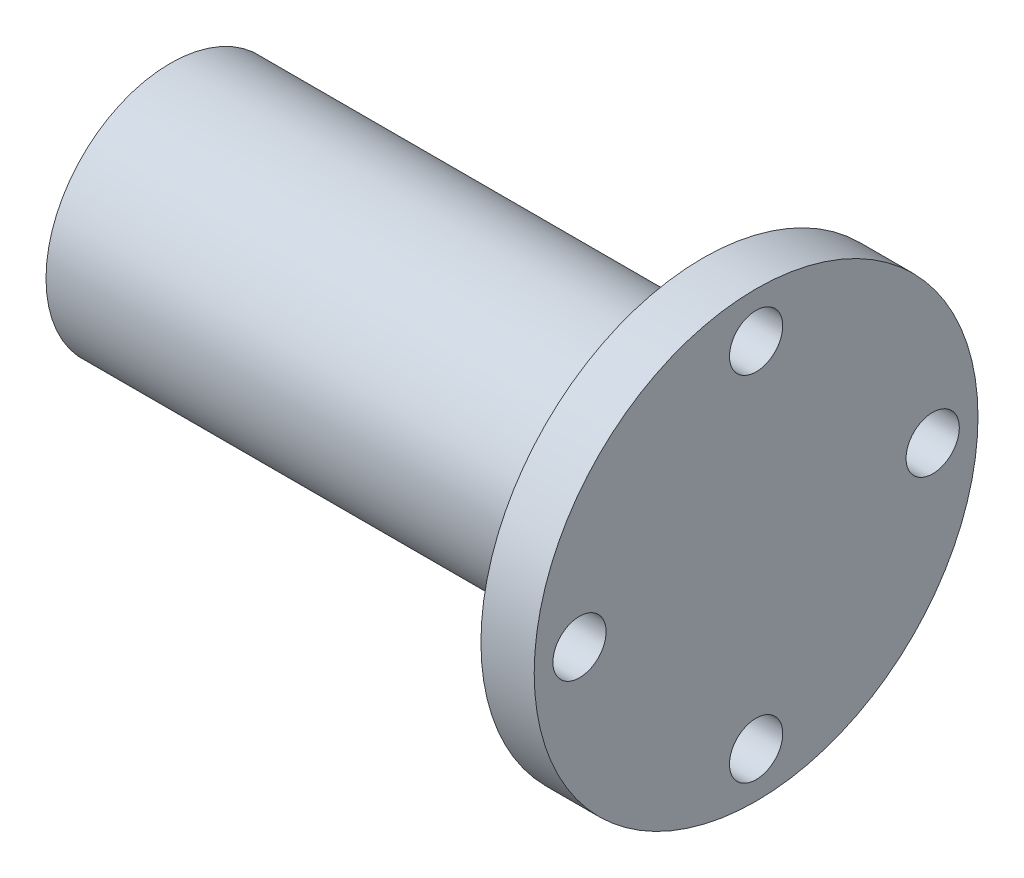
from build123d import *

# Parameters (mm, degrees)
SKETCH1_R           = 7
BOSS_EXTRUDE1_DEPTH = 30
SKETCH2_R           = 12.5
SKETCH2_R_2         = 1.5
BOSS_EXTRUDE2_DEPTH = 3


with BuildPart() as part:
    # Sketch1 → Boss-Extrude1 (new body)
    with BuildSketch(Plane(origin=(0, 0, 0), x_dir=(0, 0, -1), z_dir=(1, 0, 0))):
        Circle(SKETCH1_R)
    extrude(amount=-BOSS_EXTRUDE1_DEPTH)

    # Sketch2 → Boss-Extrude2 (add)
    with BuildSketch(Plane(origin=(0, 0, 0), x_dir=(0, 0, -1), z_dir=(1, 0, 0))):
        Circle(SKETCH2_R)
        with Locations((0, 9.94711279)):
            Circle(SKETCH2_R_2, mode=Mode.SUBTRACT)
        with Locations((9.94711279, 0)):
            Circle(SKETCH2_R_2, mode=Mode.SUBTRACT)
        with Locations((0, -9.94711279)):
            Circle(SKETCH2_R_2, mode=Mode.SUBTRACT)
        with Locations((-9.94711279, 0)):
            Circle(SKETCH2_R_2, mode=Mode.SUBTRACT)
    extrude(amount=BOSS_EXTRUDE2_DEPTH)


solid = part.part
